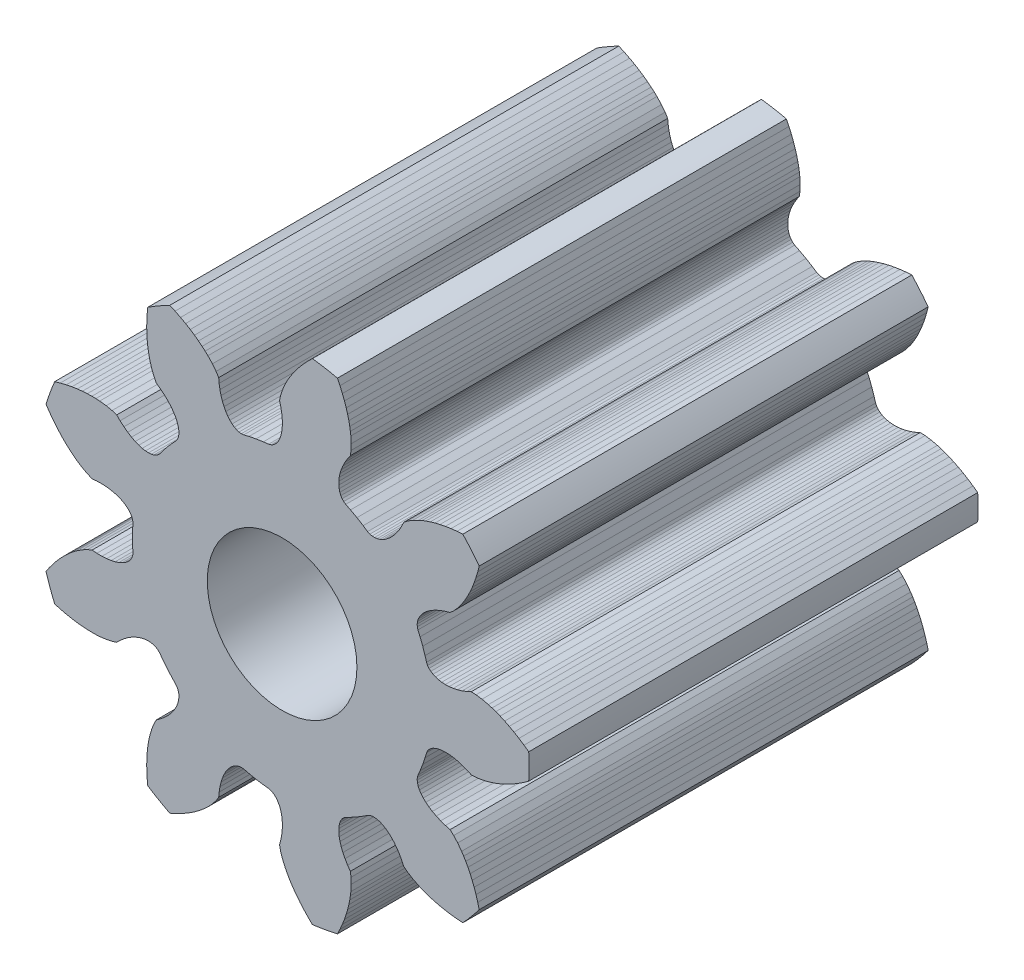
from build123d import *

# Parameters (mm, degrees)
MODEL_R                  = 0.5
RESSALTO_EXTRUS_O1_DEPTH = 3


with BuildPart() as part:
    # Model → Ressalto-extrusão1 (new body)
    with BuildSketch(Plane.XY):
        with BuildLine():
            Line((1.2957465, 0.9174505), (1.3073142, 0.9563955))
            Line((1.3073142, 0.9563955), (1.316864677, 0.994145581))
            ThreePointArc((1.316864677, 0.994145581), (1.263963887, 1.060591656), (1.207713382, 1.124226984))
            Line((1.207713382, 1.124226984), (1.1688784, 1.1213768))
            Line((1.1688784, 1.1213768), (1.1285163, 1.1167476))
            Line((1.1285163, 1.1167476), (1.0905435, 1.1107968))
            Line((1.0905435, 1.1107968), (1.0548614, 1.1036735))
            Line((1.0548614, 1.1036735), (1.0218495, 1.0956552))
            Line((1.0218495, 1.0956552), (0.9899586, 1.0864586))
            Line((0.9899586, 1.0864586), (0.9606137, 1.0766118))
            Line((0.9606137, 1.0766118), (0.9356225, 1.0670458))
            Line((0.9356225, 1.0670458), (0.9122403, 1.0569665))
            Line((0.9122403, 1.0569665), (0.8730747, 1.0371897))
            Line((0.8730747, 1.0371897), (0.8392084, 1.0161316))
            Line((0.8392084, 1.0161316), (0.813433, 0.9961873))
            Line((0.813433, 0.9961873), (0.799745, 0.967359))
            Line((0.799745, 0.967359), (0.7832057, 0.9377521))
            Line((0.7832057, 0.9377521), (0.7656816, 0.9112195))
            Line((0.7656816, 0.9112195), (0.7474159, 0.8877823))
            Line((0.7474159, 0.8877823), (0.7286208, 0.8674683))
            Line((0.7286208, 0.8674683), (0.7095369, 0.850254))
            Line((0.7095369, 0.850254), (0.6903837, 0.8361396))
            Line((0.6903837, 0.8361396), (0.671388, 0.8250982))
            Line((0.671388, 0.8250982), (0.6527755, 0.8170803))
            Line((0.6527755, 0.8170803), (0.6347615, 0.8120192))
            Line((0.6347615, 0.8120192), (0.6175544, 0.8098756))
            Line((0.6175544, 0.8098756), (0.6013719, 0.8105467))
            Line((0.6013719, 0.8105467), (0.5864196, 0.8139486))
            Line((0.5864196, 0.8139486), (0.5713083, 0.8208949))
            Line((0.5713083, 0.8208949), (0.5417017, 0.8405748))
            Line((0.5417017, 0.8405748), (0.5, 0.8660254))
            Line((0.5, 0.8660254), (0.4571083, 0.8894148))
            Line((0.4571083, 0.8894148), (0.4252617, 0.9052149))
            Line((0.4252617, 0.9052149), (0.4116904, 0.9148286))
            Line((0.4116904, 0.9148286), (0.4012681, 0.9260767))
            Line((0.4012681, 0.9260767), (0.3925956, 0.9397556))
            Line((0.3925956, 0.9397556), (0.3858485, 0.9557292))
            Line((0.3858485, 0.9557292), (0.3812245, 0.9738603))
            Line((0.3812245, 0.9738603), (0.378862, 0.9939882))
            Line((0.378862, 0.9939882), (0.3789263, 1.0159596))
            Line((0.3789263, 1.0159596), (0.3815731, 1.039604))
            Line((0.3815731, 1.039604), (0.3869392, 1.0647383))
            Line((0.3869392, 1.0647383), (0.3951341, 1.0911723))
            Line((0.3951341, 1.0911723), (0.4062984, 1.1187095))
            Line((0.4062984, 1.1187095), (0.4205143, 1.1471521))
            Line((0.4205143, 1.1471521), (0.437885, 1.176279))
            Line((0.437885, 1.176279), (0.456007, 1.2025473))
            Line((0.456007, 1.2025473), (0.4603916, 1.2348416))
            Line((0.4603916, 1.2348416), (0.4616953, 1.2746997))
            Line((0.4616953, 1.2746997), (0.4592397, 1.3185065))
            Line((0.4592397, 1.3185065), (0.4562775, 1.3437958))
            Line((0.4562775, 1.3437958), (0.4520663, 1.3702218))
            Line((0.4520663, 1.3702218), (0.4459214, 1.4005586))
            Line((0.4459214, 1.4005586), (0.4379405, 1.4327752))
            Line((0.4379405, 1.4327752), (0.4283786, 1.4653735))
            Line((0.4283786, 1.4653735), (0.4167065, 1.4998368))
            Line((0.4167065, 1.4998368), (0.4028737, 1.5356976))
            Line((0.4028737, 1.5356976), (0.3867016, 1.5729668))
            Line((0.3867016, 1.5729668), (0.369752412, 1.608023952))
            ThreePointArc((0.369752412, 1.608023952), (0.286517218, 1.624919794), (0.202523007, 1.63751105))
            Line((0.202523007, 1.63751105), (0.1746057, 1.610365))
            Line((0.1746057, 1.610365), (0.1466621, 1.5808746))
            Line((0.1466621, 1.5808746), (0.1213984, 1.5519076))
            Line((0.1213984, 1.5519076), (0.098643, 1.5235148))
            Line((0.098643, 1.5235148), (0.0785085, 1.4961528))
            Line((0.0785085, 1.4961528), (0.0599902, 1.4686086))
            Line((0.0599902, 1.4686086), (0.0438401, 1.4422031))
            Line((0.0438401, 1.4422031), (0.0308446, 1.418811))
            Line((0.0308446, 1.418811), (0.0194116, 1.3960601))
            Line((0.0194116, 1.3960601), (0.0021213, 1.355735))
            Line((0.0021213, 1.355735), (-0.0102859, 1.3178347))
            Line((-0.0102859, 1.3178347), (-0.017211, 1.2859884))
            Line((-0.017211, 1.2859884), (-0.0091662, 1.2551062))
            Line((-0.0091662, 1.2551062), (-0.002805, 1.2217947))
            Line((-0.002805, 1.2217947), (0.0008256, 1.1902053))
            Line((0.0008256, 1.1902053), (0.0018983, 1.1605104))
            Line((0.0018983, 1.1605104), (0.0005581, 1.1328677))
            Line((0.0005581, 1.1328677), (-0.0029959, 1.1074139))
            Line((-0.0029959, 1.1074139), (-0.0085956, 1.0842902))
            Line((-0.0085956, 1.0842902), (-0.0160498, 1.0636218))
            Line((-0.0160498, 1.0636218), (-0.0251541, 1.0455158))
            Line((-0.0251541, 1.0455158), (-0.0357003, 1.0300596))
            Line((-0.0357003, 1.0300596), (-0.0475039, 1.017357))
            Line((-0.0475039, 1.017357), (-0.0603318, 1.0074692))
            Line((-0.0603318, 1.0074692), (-0.0739726, 1.0004641))
            Line((-0.0739726, 1.0004641), (-0.0900136, 0.9960719))
            Line((-0.0900136, 0.9960719), (-0.1253435, 0.9921168))
            Line((-0.1253435, 0.9921168), (-0.1736482, 0.9848078))
            Line((-0.1736482, 0.9848078), (-0.2215395, 0.9751549))
            Line((-0.2215395, 0.9751549), (-0.2560916, 0.9667878))
            Line((-0.2560916, 0.9667878), (-0.2726674, 0.9654288))
            Line((-0.2726674, 0.9654288), (-0.2878814, 0.9673461))
            Line((-0.2878814, 0.9673461), (-0.3033175, 0.9722501))
            Line((-0.3033175, 0.9722501), (-0.3187538, 0.9801497))
            Line((-0.3187538, 0.9801497), (-0.3339504, 0.9910667))
            Line((-0.3339504, 0.9910667), (-0.3486982, 1.0049669))
            Line((-0.3486982, 1.0049669), (-0.3627719, 1.0218394))
            Line((-0.3627719, 1.0218394), (-0.3759426, 1.0416533))
            Line((-0.3759426, 1.0416533), (-0.387988, 1.0643566))
            Line((-0.387988, 1.0643566), (-0.3987018, 1.0898738))
            Line((-0.3987018, 1.0898738), (-0.40785, 1.1181447))
            Line((-0.40785, 1.1181447), (-0.4152425, 1.1490709))
            Line((-0.4152425, 1.1490709), (-0.4206582, 1.182549))
            Line((-0.4206582, 1.182549), (-0.4236609, 1.2143203))
            Line((-0.4236609, 1.2143203), (-0.4410605, 1.2418776))
            Line((-0.4410605, 1.2418776), (-0.4656821, 1.2732487))
            Line((-0.4656821, 1.2732487), (-0.4957216, 1.3052282))
            Line((-0.4957216, 1.3052282), (-0.5142464, 1.3226968))
            Line((-0.5142464, 1.3226968), (-0.5344587, 1.3402334))
            Line((-0.5344587, 1.3402334), (-0.5586661, 1.3595229))
            Line((-0.5586661, 1.3595229), (-0.5854883, 1.3790722))
            Line((-0.5854883, 1.3790722), (-0.6137669, 1.3978977))
            Line((-0.6137669, 1.3978977), (-0.6448608, 1.4167954))
            Line((-0.6448608, 1.4167954), (-0.6785083, 1.4353748))
            Line((-0.6785083, 1.4353748), (-0.714853, 1.4535295))
            Line((-0.714853, 1.4535295), (-0.750371097, 1.469490095))
            ThreePointArc((-0.750371097, 1.469490095), (-0.824993613, 1.428930867), (-0.897430198, 1.384585495))
            Line((-0.897430198, 1.384585495), (-0.901367, 1.3458456))
            Line((-0.901367, 1.3458456), (-0.9038169, 1.3052928))
            Line((-0.9038169, 1.3052928), (-0.9045504, 1.2668636))
            Line((-0.9045504, 1.2668636), (-0.9037315, 1.2304866))
            Line((-0.9037315, 1.2304866), (-0.9015675, 1.1965838))
            Line((-0.9015675, 1.1965838), (-0.8980483, 1.1635804))
            Line((-0.8980483, 1.1635804), (-0.8934468, 1.1329715))
            Line((-0.8934468, 1.1329715), (-0.8883658, 1.1066989))
            Line((-0.8883658, 1.1066989), (-0.8825, 1.0819216))
            Line((-0.8825, 1.0819216), (-0.8698247, 1.0399168))
            Line((-0.8698247, 1.0399168), (-0.8549673, 1.0029084))
            Line((-0.8549673, 1.0029084), (-0.8398018, 0.9740612))
            Line((-0.8398018, 0.9740612), (-0.8137884, 0.9555752))
            Line((-0.8137884, 0.9555752), (-0.7875033, 0.934146))
            Line((-0.7875033, 0.934146), (-0.7644168, 0.9122808))
            Line((-0.7644168, 0.9122808), (-0.7445075, 0.8902228))
            Line((-0.7445075, 0.8902228), (-0.7277658, 0.8681857))
            Line((-0.7277658, 0.8681857), (-0.7141269, 0.8464025))
            Line((-0.7141269, 0.8464025), (-0.7035529, 0.8250893))
            Line((-0.7035529, 0.8250893), (-0.6959778, 0.8044649))
            Line((-0.6959778, 0.8044649), (-0.6913137, 0.7847428))
            Line((-0.6913137, 0.7847428), (-0.6894576, 0.7661237))
            Line((-0.6894576, 0.7661237), (-0.6903345, 0.7488058))
            Line((-0.6903345, 0.7488058), (-0.6938055, 0.7329857))
            Line((-0.6938055, 0.7329857), (-0.6997522, 0.7188513))
            Line((-0.6997522, 0.7188513), (-0.7092171, 0.7051757))
            Line((-0.7092171, 0.7051757), (-0.7337391, 0.6794363))
            Line((-0.7337391, 0.6794363), (-0.7660444, 0.6427876))
            Line((-0.7660444, 0.6427876), (-0.7965266, 0.6046091))
            Line((-0.7965266, 0.6046091), (-0.8176168, 0.57599))
            Line((-0.8176168, 0.57599), (-0.829441, 0.5642942))
            Line((-0.829441, 0.5642942), (-0.8423281, 0.5559835))
            Line((-0.8423281, 0.5559835), (-0.857305, 0.5498181))
            Line((-0.857305, 0.5498181), (-0.8742076, 0.5459472))
            Line((-0.8742076, 0.5459472), (-0.8928662, 0.5445419))
            Line((-0.8928662, 0.5445419), (-0.9130986, 0.5457104))
            Line((-0.9130986, 0.5457104), (-0.9347251, 0.5495891))
            Line((-0.9347251, 0.5495891), (-0.9575506, 0.5563015))
            Line((-0.9575506, 0.5563015), (-0.9813713, 0.5659506))
            Line((-0.9813713, 0.5659506), (-1.0059807, 0.5786112))
            Line((-1.0059807, 0.5786112), (-1.0311608, 0.5943877))
            Line((-1.0311608, 0.5943877), (-1.0567027, 0.6133266))
            Line((-1.0567027, 0.6133266), (-1.0823708, 0.6354912))
            Line((-1.0823708, 0.6354912), (-1.1050931, 0.6578994))
            Line((-1.1050931, 0.6578994), (-1.1361354, 0.6678252))
            Line((-1.1361354, 0.6678252), (-1.1751616, 0.6760304))
            Line((-1.1751616, 0.6760304), (-1.2187293, 0.6812191))
            Line((-1.2187293, 0.6812191), (-1.2441487, 0.6826933))
            Line((-1.2441487, 0.6826933), (-1.2709045, 0.6831349))
            Line((-1.2709045, 0.6831349), (-1.3018475, 0.6823513))
            Line((-1.3018475, 0.6823513), (-1.3349606, 0.680086))
            Line((-1.3349606, 0.680086), (-1.368724, 0.67633))
            Line((-1.368724, 0.67633), (-1.4046906, 0.6708197))
            Line((-1.4046906, 0.6708197), (-1.4424087, 0.6634242))
            Line((-1.4424087, 0.6634242), (-1.4819199, 0.6539695))
            Line((-1.4819199, 0.6539695), (-1.519387572, 0.643365487))
            ThreePointArc((-1.519387572, 0.643365487), (-1.55048037, 0.564328724), (-1.577465771, 0.483796991))
            Line((-1.577465771, 0.483796991), (-1.55558, 0.45159))
            Line((-1.55558, 0.45159), (-1.53139, 0.41895))
            Line((-1.53139, 0.41895), (-1.50725, 0.38904))
            Line((-1.50725, 0.38904), (-1.48324, 0.3617))
            Line((-1.48324, 0.3617), (-1.45979, 0.33712))
            Line((-1.45979, 0.33712), (-1.43588, 0.3141))
            Line((-1.43588, 0.3141), (-1.41268, 0.29361))
            Line((-1.41268, 0.29361), (-1.3919, 0.27675))
            Line((-1.3919, 0.27675), (-1.37148, 0.26154))
            Line((-1.37148, 0.26154), (-1.33477, 0.23751))
            Line((-1.33477, 0.23751), (-1.2996, 0.21871))
            Line((-1.2996, 0.21871), (-1.26944, 0.20636))
            Line((-1.26944, 0.20636), (-1.23763, 0.20892))
            Line((-1.23763, 0.20892), (-1.20372, 0.2094))
            Line((-1.20372, 0.2094), (-1.17198, 0.20749))
            Line((-1.17198, 0.20749), (-1.14255, 0.20339))
            Line((-1.14255, 0.20339), (-1.11556, 0.19727))
            Line((-1.11556, 0.19727), (-1.09111, 0.18935))
            Line((-1.09111, 0.18935), (-1.06931, 0.17982))
            Line((-1.06931, 0.17982), (-1.05025, 0.16889))
            Line((-1.05025, 0.16889), (-1.034, 0.15678))
            Line((-1.034, 0.15678), (-1.02061, 0.14371))
            Line((-1.02061, 0.14371), (-1.01015, 0.12988))
            Line((-1.01015, 0.12988), (-1.00264, 0.11553))
            Line((-1.00264, 0.11553), (-0.99811, 0.10088))
            Line((-0.99811, 0.10088), (-0.99657, 0.08432))
            Line((-0.99657, 0.08432), (-0.99881, 0.04884))
            Line((-0.99881, 0.04884), (-1, 0))
            Line((-1, 0), (-0.99881, -0.04884))
            Line((-0.99881, -0.04884), (-0.99657, -0.08432))
            Line((-0.99657, -0.08432), (-0.99811, -0.10088))
            Line((-0.99811, -0.10088), (-1.00264, -0.11553))
            Line((-1.00264, -0.11553), (-1.01015, -0.12988))
            Line((-1.01015, -0.12988), (-1.02061, -0.14371))
            Line((-1.02061, -0.14371), (-1.034, -0.15678))
            Line((-1.034, -0.15678), (-1.05025, -0.16889))
            Line((-1.05025, -0.16889), (-1.06931, -0.17982))
            Line((-1.06931, -0.17982), (-1.09111, -0.18935))
            Line((-1.09111, -0.18935), (-1.11556, -0.19727))
            Line((-1.11556, -0.19727), (-1.14255, -0.20339))
            Line((-1.14255, -0.20339), (-1.17198, -0.20749))
            Line((-1.17198, -0.20749), (-1.20372, -0.2094))
            Line((-1.20372, -0.2094), (-1.23763, -0.20892))
            Line((-1.23763, -0.20892), (-1.26944, -0.20636))
            Line((-1.26944, -0.20636), (-1.2996, -0.21871))
            Line((-1.2996, -0.21871), (-1.33477, -0.23751))
            Line((-1.33477, -0.23751), (-1.37148, -0.26154))
            Line((-1.37148, -0.26154), (-1.3919, -0.27675))
            Line((-1.3919, -0.27675), (-1.41268, -0.29361))
            Line((-1.41268, -0.29361), (-1.43588, -0.3141))
            Line((-1.43588, -0.3141), (-1.45979, -0.33712))
            Line((-1.45979, -0.33712), (-1.48324, -0.3617))
            Line((-1.48324, -0.3617), (-1.50725, -0.38904))
            Line((-1.50725, -0.38904), (-1.53139, -0.41895))
            Line((-1.53139, -0.41895), (-1.55558, -0.45159))
            Line((-1.55558, -0.45159), (-1.577465771, -0.483796991))
            ThreePointArc((-1.577465771, -0.483796991), (-1.550480775, -0.564328872), (-1.519387572, -0.643365487))
            Line((-1.519387572, -0.643365487), (-1.4819199, -0.6539695))
            Line((-1.4819199, -0.6539695), (-1.4424087, -0.6634242))
            Line((-1.4424087, -0.6634242), (-1.4046906, -0.6708197))
            Line((-1.4046906, -0.6708197), (-1.368724, -0.67633))
            Line((-1.368724, -0.67633), (-1.3349606, -0.680086))
            Line((-1.3349606, -0.680086), (-1.3018475, -0.6823513))
            Line((-1.3018475, -0.6823513), (-1.2709045, -0.6831349))
            Line((-1.2709045, -0.6831349), (-1.2441487, -0.6826933))
            Line((-1.2441487, -0.6826933), (-1.2187293, -0.6812191))
            Line((-1.2187293, -0.6812191), (-1.1751616, -0.6760304))
            Line((-1.1751616, -0.6760304), (-1.1361354, -0.6678252))
            Line((-1.1361354, -0.6678252), (-1.1050931, -0.6578994))
            Line((-1.1050931, -0.6578994), (-1.0823708, -0.6354912))
            Line((-1.0823708, -0.6354912), (-1.0567027, -0.6133266))
            Line((-1.0567027, -0.6133266), (-1.0311608, -0.5943877))
            Line((-1.0311608, -0.5943877), (-1.0059807, -0.5786112))
            Line((-1.0059807, -0.5786112), (-0.9813713, -0.5659506))
            Line((-0.9813713, -0.5659506), (-0.9575506, -0.5563015))
            Line((-0.9575506, -0.5563015), (-0.9347251, -0.5495891))
            Line((-0.9347251, -0.5495891), (-0.9130986, -0.5457104))
            Line((-0.9130986, -0.5457104), (-0.8928662, -0.5445419))
            Line((-0.8928662, -0.5445419), (-0.8742076, -0.5459472))
            Line((-0.8742076, -0.5459472), (-0.857305, -0.5498181))
            Line((-0.857305, -0.5498181), (-0.8423281, -0.5559835))
            Line((-0.8423281, -0.5559835), (-0.829441, -0.5642942))
            Line((-0.829441, -0.5642942), (-0.8176168, -0.57599))
            Line((-0.8176168, -0.57599), (-0.7965266, -0.6046091))
            Line((-0.7965266, -0.6046091), (-0.7660444, -0.6427876))
            Line((-0.7660444, -0.6427876), (-0.7337391, -0.6794363))
            Line((-0.7337391, -0.6794363), (-0.7092171, -0.7051757))
            Line((-0.7092171, -0.7051757), (-0.6997522, -0.7188513))
            Line((-0.6997522, -0.7188513), (-0.6938055, -0.7329857))
            Line((-0.6938055, -0.7329857), (-0.6903345, -0.7488058))
            Line((-0.6903345, -0.7488058), (-0.6894576, -0.7661237))
            Line((-0.6894576, -0.7661237), (-0.6913137, -0.7847428))
            Line((-0.6913137, -0.7847428), (-0.6959778, -0.8044649))
            Line((-0.6959778, -0.8044649), (-0.7035529, -0.8250893))
            Line((-0.7035529, -0.8250893), (-0.7141269, -0.8464025))
            Line((-0.7141269, -0.8464025), (-0.7277658, -0.8681857))
            Line((-0.7277658, -0.8681857), (-0.7445075, -0.8902228))
            Line((-0.7445075, -0.8902228), (-0.7644168, -0.9122808))
            Line((-0.7644168, -0.9122808), (-0.7875033, -0.934146))
            Line((-0.7875033, -0.934146), (-0.8137884, -0.9555752))
            Line((-0.8137884, -0.9555752), (-0.8398018, -0.9740612))
            Line((-0.8398018, -0.9740612), (-0.8549673, -1.0029084))
            Line((-0.8549673, -1.0029084), (-0.8698247, -1.0399168))
            Line((-0.8698247, -1.0399168), (-0.8825, -1.0819216))
            Line((-0.8825, -1.0819216), (-0.8883658, -1.1066989))
            Line((-0.8883658, -1.1066989), (-0.8934468, -1.1329715))
            Line((-0.8934468, -1.1329715), (-0.8980483, -1.1635804))
            Line((-0.8980483, -1.1635804), (-0.9015675, -1.1965838))
            Line((-0.9015675, -1.1965838), (-0.9037315, -1.2304866))
            Line((-0.9037315, -1.2304866), (-0.9045504, -1.2668636))
            Line((-0.9045504, -1.2668636), (-0.9038169, -1.3052928))
            Line((-0.9038169, -1.3052928), (-0.901367, -1.3458456))
            Line((-0.901367, -1.3458456), (-0.897430198, -1.384585495))
            ThreePointArc((-0.897430198, -1.384585495), (-0.8249934, -1.428930498), (-0.750371097, -1.469490095))
            Line((-0.750371097, -1.469490095), (-0.714853, -1.4535295))
            Line((-0.714853, -1.4535295), (-0.6785083, -1.4353748))
            Line((-0.6785083, -1.4353748), (-0.6448608, -1.4167954))
            Line((-0.6448608, -1.4167954), (-0.6137669, -1.3978977))
            Line((-0.6137669, -1.3978977), (-0.5854883, -1.3790722))
            Line((-0.5854883, -1.3790722), (-0.5586661, -1.3595229))
            Line((-0.5586661, -1.3595229), (-0.5344587, -1.3402334))
            Line((-0.5344587, -1.3402334), (-0.5142464, -1.3226968))
            Line((-0.5142464, -1.3226968), (-0.4957216, -1.3052282))
            Line((-0.4957216, -1.3052282), (-0.4656821, -1.2732487))
            Line((-0.4656821, -1.2732487), (-0.4410605, -1.2418776))
            Line((-0.4410605, -1.2418776), (-0.4236609, -1.2143203))
            Line((-0.4236609, -1.2143203), (-0.4206582, -1.182549))
            Line((-0.4206582, -1.182549), (-0.4152425, -1.1490709))
            Line((-0.4152425, -1.1490709), (-0.40785, -1.1181447))
            Line((-0.40785, -1.1181447), (-0.3987018, -1.0898738))
            Line((-0.3987018, -1.0898738), (-0.387988, -1.0643566))
            Line((-0.387988, -1.0643566), (-0.3759426, -1.0416533))
            Line((-0.3759426, -1.0416533), (-0.3627719, -1.0218394))
            Line((-0.3627719, -1.0218394), (-0.3486982, -1.0049669))
            Line((-0.3486982, -1.0049669), (-0.3339504, -0.9910667))
            Line((-0.3339504, -0.9910667), (-0.3187538, -0.9801497))
            Line((-0.3187538, -0.9801497), (-0.3033175, -0.9722501))
            Line((-0.3033175, -0.9722501), (-0.2878814, -0.9673461))
            Line((-0.2878814, -0.9673461), (-0.2726674, -0.9654288))
            Line((-0.2726674, -0.9654288), (-0.2560916, -0.9667878))
            Line((-0.2560916, -0.9667878), (-0.2215395, -0.9751549))
            Line((-0.2215395, -0.9751549), (-0.1736482, -0.9848078))
            Line((-0.1736482, -0.9848078), (-0.1253435, -0.9921168))
            Line((-0.1253435, -0.9921168), (-0.0900136, -0.9960719))
            Line((-0.0900136, -0.9960719), (-0.0739726, -1.0004641))
            Line((-0.0739726, -1.0004641), (-0.0603318, -1.0074692))
            Line((-0.0603318, -1.0074692), (-0.0475039, -1.017357))
            Line((-0.0475039, -1.017357), (-0.0357003, -1.0300596))
            Line((-0.0357003, -1.0300596), (-0.0251541, -1.0455158))
            Line((-0.0251541, -1.0455158), (-0.0160498, -1.0636218))
            Line((-0.0160498, -1.0636218), (-0.0085956, -1.0842902))
            Line((-0.0085956, -1.0842902), (-0.0029959, -1.1074139))
            Line((-0.0029959, -1.1074139), (0.0005581, -1.1328677))
            Line((0.0005581, -1.1328677), (0.0018983, -1.1605104))
            Line((0.0018983, -1.1605104), (0.0008256, -1.1902053))
            Line((0.0008256, -1.1902053), (-0.002805, -1.2217947))
            Line((-0.002805, -1.2217947), (-0.0091662, -1.2551062))
            Line((-0.0091662, -1.2551062), (-0.017211, -1.2859884))
            Line((-0.017211, -1.2859884), (-0.0102859, -1.3178347))
            Line((-0.0102859, -1.3178347), (0.0021213, -1.355735))
            Line((0.0021213, -1.355735), (0.0194116, -1.3960601))
            Line((0.0194116, -1.3960601), (0.0308446, -1.418811))
            Line((0.0308446, -1.418811), (0.0438401, -1.4422031))
            Line((0.0438401, -1.4422031), (0.0599902, -1.4686086))
            Line((0.0599902, -1.4686086), (0.0785085, -1.4961528))
            Line((0.0785085, -1.4961528), (0.098643, -1.5235148))
            Line((0.098643, -1.5235148), (0.1213984, -1.5519076))
            Line((0.1213984, -1.5519076), (0.1466621, -1.5808746))
            Line((0.1466621, -1.5808746), (0.1746057, -1.610365))
            Line((0.1746057, -1.610365), (0.202523007, -1.63751115))
            ThreePointArc((0.202523007, -1.63751115), (0.286517293, -1.624920322), (0.369752412, -1.608024052))
            Line((0.369752412, -1.608024052), (0.3867016, -1.5729668))
            Line((0.3867016, -1.5729668), (0.4028737, -1.5356976))
            Line((0.4028737, -1.5356976), (0.4167065, -1.4998368))
            Line((0.4167065, -1.4998368), (0.4283786, -1.4653735))
            Line((0.4283786, -1.4653735), (0.4379405, -1.4327752))
            Line((0.4379405, -1.4327752), (0.4459214, -1.4005586))
            Line((0.4459214, -1.4005586), (0.4520663, -1.3702218))
            Line((0.4520663, -1.3702218), (0.4562775, -1.3437958))
            Line((0.4562775, -1.3437958), (0.4592397, -1.3185065))
            Line((0.4592397, -1.3185065), (0.4616953, -1.2746997))
            Line((0.4616953, -1.2746997), (0.4603916, -1.2348416))
            Line((0.4603916, -1.2348416), (0.456007, -1.2025473))
            Line((0.456007, -1.2025473), (0.437885, -1.176279))
            Line((0.437885, -1.176279), (0.4205143, -1.1471521))
            Line((0.4205143, -1.1471521), (0.4062984, -1.1187095))
            Line((0.4062984, -1.1187095), (0.3951341, -1.0911723))
            Line((0.3951341, -1.0911723), (0.3869392, -1.0647383))
            Line((0.3869392, -1.0647383), (0.3815731, -1.039604))
            Line((0.3815731, -1.039604), (0.3789263, -1.0159596))
            Line((0.3789263, -1.0159596), (0.378862, -0.9939882))
            Line((0.378862, -0.9939882), (0.3812245, -0.9738603))
            Line((0.3812245, -0.9738603), (0.3858485, -0.9557292))
            Line((0.3858485, -0.9557292), (0.3925956, -0.9397556))
            Line((0.3925956, -0.9397556), (0.4012681, -0.9260767))
            Line((0.4012681, -0.9260767), (0.4116904, -0.9148286))
            Line((0.4116904, -0.9148286), (0.4252617, -0.9052149))
            Line((0.4252617, -0.9052149), (0.4571083, -0.8894148))
            Line((0.4571083, -0.8894148), (0.5, -0.8660254))
            Line((0.5, -0.8660254), (0.5417017, -0.8405748))
            Line((0.5417017, -0.8405748), (0.5713083, -0.8208949))
            Line((0.5713083, -0.8208949), (0.5864196, -0.8139486))
            Line((0.5864196, -0.8139486), (0.6013719, -0.8105467))
            Line((0.6013719, -0.8105467), (0.6175544, -0.8098756))
            Line((0.6175544, -0.8098756), (0.6347615, -0.8120192))
            Line((0.6347615, -0.8120192), (0.6527755, -0.8170803))
            Line((0.6527755, -0.8170803), (0.671388, -0.8250982))
            Line((0.671388, -0.8250982), (0.6903837, -0.8361396))
            Line((0.6903837, -0.8361396), (0.7095369, -0.850254))
            Line((0.7095369, -0.850254), (0.7286208, -0.8674683))
            Line((0.7286208, -0.8674683), (0.7474159, -0.8877823))
            Line((0.7474159, -0.8877823), (0.7656816, -0.9112195))
            Line((0.7656816, -0.9112195), (0.7832057, -0.9377521))
            Line((0.7832057, -0.9377521), (0.799745, -0.967359))
            Line((0.799745, -0.967359), (0.813433, -0.9961873))
            Line((0.813433, -0.9961873), (0.8392084, -1.0161316))
            Line((0.8392084, -1.0161316), (0.8730747, -1.0371897))
            Line((0.8730747, -1.0371897), (0.9122403, -1.0569665))
            Line((0.9122403, -1.0569665), (0.9356225, -1.0670458))
            Line((0.9356225, -1.0670458), (0.9606137, -1.0766118))
            Line((0.9606137, -1.0766118), (0.9899586, -1.0864586))
            Line((0.9899586, -1.0864586), (1.0218495, -1.0956552))
            Line((1.0218495, -1.0956552), (1.0548614, -1.1036735))
            Line((1.0548614, -1.1036735), (1.0905435, -1.1107968))
            Line((1.0905435, -1.1107968), (1.1285163, -1.1167476))
            Line((1.1285163, -1.1167476), (1.1688784, -1.1213768))
            Line((1.1688784, -1.1213768), (1.207713435, -1.124227034))
            ThreePointArc((1.207713435, -1.124227034), (1.263963274, -1.060591141), (1.316864741, -0.99414563))
            Line((1.316864741, -0.99414563), (1.3073142, -0.9563955))
            Line((1.3073142, -0.9563955), (1.2957465, -0.9174505))
            Line((1.2957465, -0.9174505), (1.2832922, -0.8810879))
            Line((1.2832922, -0.8810879), (1.270081, -0.8471848))
            Line((1.270081, -0.8471848), (1.2564521, -0.8160668))
            Line((1.2564521, -0.8160668), (1.2418573, -0.7862573))
            Line((1.2418573, -0.7862573), (1.2270644, -0.7590682))
            Line((1.2270644, -0.7590682), (1.2133041, -0.7361178))
            Line((1.2133041, -0.7361178), (1.1993177, -0.714841))
            Line((1.1993177, -0.714841), (1.1730403, -0.6797046))
            Line((1.1730403, -0.6797046), (1.1464213, -0.6500096))
            Line((1.1464213, -0.6500096), (1.1223041, -0.628089))
            Line((1.1223041, -0.628089), (1.0915369, -0.619615))
            Line((1.0915369, -0.619615), (1.0595078, -0.6084681))
            Line((1.0595078, -0.6084681), (1.0303352, -0.5958176))
            Line((1.0303352, -0.5958176), (1.0040823, -0.5818992))
            Line((1.0040823, -0.5818992), (0.9808132, -0.5669172))
            Line((0.9808132, -0.5669172), (0.9605465, -0.5511124))
            Line((0.9605465, -0.5511124), (0.9433207, -0.5347011))
            Line((0.9433207, -0.5347011), (0.9291484, -0.5179113))
            Line((0.9291484, -0.5179113), (0.9180203, -0.5009738))
            Line((0.9180203, -0.5009738), (0.909908, -0.4841124))
            Line((0.909908, -0.4841124), (0.9048089, -0.4675389))
            Line((0.9048089, -0.4675389), (0.9026598, -0.4514858))
            Line((0.9026598, -0.4514858), (0.9034136, -0.4361699))
            Line((0.9034136, -0.4361699), (0.9076303, -0.4200819))
            Line((0.9076303, -0.4200819), (0.9218701, -0.3875077))
            Line((0.9218701, -0.3875077), (0.9396926, -0.3420201))
            Line((0.9396926, -0.3420201), (0.9552787, -0.2957186))
            Line((0.9552787, -0.2957186), (0.9653086, -0.2616121))
            Line((0.9653086, -0.2616121), (0.9724196, -0.2465775))
            Line((0.9724196, -0.2465775), (0.981687, -0.2343604))
            Line((0.981687, -0.2343604), (0.9936521, -0.2234444))
            Line((0.9936521, -0.2234444), (1.0082114, -0.214026))
            Line((1.0082114, -0.214026), (1.0252641, -0.2063238))
            Line((1.0252641, -0.2063238), (1.044676, -0.200502))
            Line((1.044676, -0.200502), (1.0663248, -0.19675))
            Line((1.0663248, -0.19675), (1.0900695, -0.1952508))
            Line((1.0900695, -0.1952508), (1.1157538, -0.1961708))
            Line((1.1157538, -0.1961708), (1.1432093, -0.199651))
            Line((1.1432093, -0.199651), (1.1722667, -0.2058639))
            Line((1.1722667, -0.2058639), (1.2027458, -0.2149249))
            Line((1.2027458, -0.2149249), (1.2344466, -0.2269738))
            Line((1.2344466, -0.2269738), (1.2634627, -0.2402591))
            Line((1.2634627, -0.2402591), (1.2960278, -0.2389692))
            Line((1.2960278, -0.2389692), (1.3355067, -0.2333318))
            Line((1.3355067, -0.2333318), (1.3782216, -0.2233066))
            Line((1.3782216, -0.2233066), (1.4026122, -0.2159979))
            Line((1.4026122, -0.2159979), (1.4279055, -0.2072619))
            Line((1.4279055, -0.2072619), (1.4567144, -0.1959424))
            Line((1.4567144, -0.1959424), (1.4870557, -0.1824884))
            Line((1.4870557, -0.1824884), (1.5174984, -0.1674111))
            Line((1.5174984, -0.1674111), (1.5494112, -0.1499318))
            Line((1.5494112, -0.1499318), (1.5823252, -0.130082))
            Line((1.5823252, -0.130082), (1.6162199, -0.1076839))
            Line((1.6162199, -0.1076839), (1.64780127, -0.084904598))
            ThreePointArc((1.64780127, -0.084904598), (1.6499872, 0), (1.64780127, 0.084904598))
            Line((1.64780127, 0.084904598), (1.6162199, 0.1076839))
            Line((1.6162199, 0.1076839), (1.5823252, 0.130082))
            Line((1.5823252, 0.130082), (1.5494112, 0.1499318))
            Line((1.5494112, 0.1499318), (1.5174984, 0.1674111))
            Line((1.5174984, 0.1674111), (1.4870557, 0.1824884))
            Line((1.4870557, 0.1824884), (1.4567144, 0.1959424))
            Line((1.4567144, 0.1959424), (1.4279055, 0.2072619))
            Line((1.4279055, 0.2072619), (1.4026122, 0.2159979))
            Line((1.4026122, 0.2159979), (1.3782216, 0.2233066))
            Line((1.3782216, 0.2233066), (1.3355067, 0.2333318))
            Line((1.3355067, 0.2333318), (1.2960278, 0.2389692))
            Line((1.2960278, 0.2389692), (1.2634627, 0.2402591))
            Line((1.2634627, 0.2402591), (1.2344466, 0.2269738))
            Line((1.2344466, 0.2269738), (1.2027458, 0.2149249))
            Line((1.2027458, 0.2149249), (1.1722667, 0.2058639))
            Line((1.1722667, 0.2058639), (1.1432093, 0.199651))
            Line((1.1432093, 0.199651), (1.1157538, 0.1961708))
            Line((1.1157538, 0.1961708), (1.0900695, 0.1952508))
            Line((1.0900695, 0.1952508), (1.0663248, 0.19675))
            Line((1.0663248, 0.19675), (1.044676, 0.200502))
            Line((1.044676, 0.200502), (1.0252641, 0.2063238))
            Line((1.0252641, 0.2063238), (1.0082114, 0.214026))
            Line((1.0082114, 0.214026), (0.9936521, 0.2234444))
            Line((0.9936521, 0.2234444), (0.981687, 0.2343604))
            Line((0.981687, 0.2343604), (0.9724196, 0.2465775))
            Line((0.9724196, 0.2465775), (0.9653086, 0.2616121))
            Line((0.9653086, 0.2616121), (0.9552787, 0.2957186))
            Line((0.9552787, 0.2957186), (0.9396926, 0.3420201))
            Line((0.9396926, 0.3420201), (0.9218701, 0.3875077))
            Line((0.9218701, 0.3875077), (0.9076303, 0.4200819))
            Line((0.9076303, 0.4200819), (0.9034136, 0.4361699))
            Line((0.9034136, 0.4361699), (0.9026598, 0.4514858))
            Line((0.9026598, 0.4514858), (0.9048089, 0.4675389))
            Line((0.9048089, 0.4675389), (0.909908, 0.4841124))
            Line((0.909908, 0.4841124), (0.9180203, 0.5009738))
            Line((0.9180203, 0.5009738), (0.9291484, 0.5179113))
            Line((0.9291484, 0.5179113), (0.9433207, 0.5347011))
            Line((0.9433207, 0.5347011), (0.9605465, 0.5511124))
            Line((0.9605465, 0.5511124), (0.9808132, 0.5669172))
            Line((0.9808132, 0.5669172), (1.0040823, 0.5818992))
            Line((1.0040823, 0.5818992), (1.0303352, 0.5958176))
            Line((1.0303352, 0.5958176), (1.0595078, 0.6084681))
            Line((1.0595078, 0.6084681), (1.0915369, 0.619615))
            Line((1.0915369, 0.619615), (1.1223041, 0.628089))
            Line((1.1223041, 0.628089), (1.1464213, 0.6500096))
            Line((1.1464213, 0.6500096), (1.1730403, 0.6797046))
            Line((1.1730403, 0.6797046), (1.1993177, 0.714841))
            Line((1.1993177, 0.714841), (1.2133041, 0.7361178))
            Line((1.2133041, 0.7361178), (1.2270644, 0.7590682))
            Line((1.2270644, 0.7590682), (1.2418573, 0.7862573))
            Line((1.2418573, 0.7862573), (1.2564521, 0.8160668))
            Line((1.2564521, 0.8160668), (1.270081, 0.8471848))
            Line((1.270081, 0.8471848), (1.2832922, 0.8810879))
            Line((1.2832922, 0.8810879), (1.2957465, 0.9174505))
        make_face()
        Circle(MODEL_R, mode=Mode.SUBTRACT)
    extrude(amount=RESSALTO_EXTRUS_O1_DEPTH)


solid = part.part
